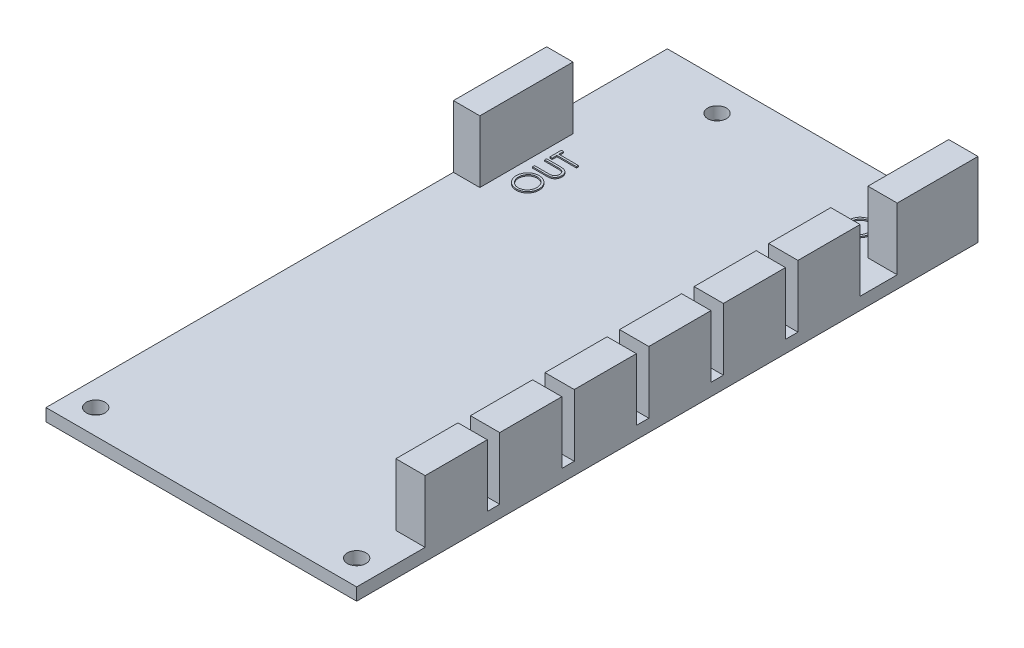
from build123d import *

# Parameters (mm, degrees)
SKIZZE1_W                       = 50
SKIZZE1_H                       = 100
SKIZZE1_R                       = 1.5
AUFSATZ_LINEAR_AUSTRAGEN1_DEPTH = 2
SKIZZE2_W                       = 4.251019897
SKIZZE2_H                       = 15
SKIZZE2_W_2                     = 4.710285564
SKIZZE2_H_2                     = 13
SKIZZE2_H_3                     = 10
AUFSATZ_LINEAR_AUSTRAGEN2_DEPTH = 10
SKIZZE3_W                       = 3.5
SKIZZE3_H                       = 0.314102564
AUFSATZ_LINEAR_AUSTRAGEN3_DEPTH = 0.2


with BuildPart() as part:
    # Skizze1 → Aufsatz-Linear austragen1 (new body)
    with BuildSketch(Plane(origin=(0, 0, 0), x_dir=(1, 0, 0), z_dir=(0, 1, 0))):
        Rectangle(SKIZZE1_W, SKIZZE1_H)
        with Locations(Location((-21, -46, 0), (0, 0, 270))):
            Circle(SKIZZE1_R, mode=Mode.SUBTRACT)
        with Locations(Location((21, -46, 0), (0, 0, 270))):
            Circle(SKIZZE1_R, mode=Mode.SUBTRACT)
        with Locations(Location((-12, 45, 0), (0, 0, 270))):
            Circle(SKIZZE1_R, mode=Mode.SUBTRACT)
    extrude(amount=AUFSATZ_LINEAR_AUSTRAGEN1_DEPTH)

    # Skizze2 → Aufsatz-Linear austragen2 (add)
    with BuildSketch(Plane(origin=(0, 2, 0), x_dir=(1, 0, 0), z_dir=(0, 1, 0))):
        with Locations((-22.874490052, 23.070720831)):
            Rectangle(SKIZZE2_W, SKIZZE2_H)
        with Locations((22.644857218, 43.5)):
            Rectangle(SKIZZE2_W_2, SKIZZE2_H_2)
        with Locations((22.644857218, 26.019961823)):
            Rectangle(SKIZZE2_W_2, SKIZZE2_H_3)
        with Locations((22.644857218, 14.019961823)):
            Rectangle(SKIZZE2_W_2, SKIZZE2_H_3)
        with Locations((22.644857218, 2.019961823)):
            Rectangle(SKIZZE2_W_2, SKIZZE2_H_3)
        with Locations((22.644857218, -9.980038177)):
            Rectangle(SKIZZE2_W_2, SKIZZE2_H_3)
        with Locations((22.644857218, -21.980038177)):
            Rectangle(SKIZZE2_W_2, SKIZZE2_H_3)
        with Locations((22.644857218, -33.980038177)):
            Rectangle(SKIZZE2_W_2, SKIZZE2_H_3)
    extrude(amount=AUFSATZ_LINEAR_AUSTRAGEN2_DEPTH)

    # Skizze3 → Aufsatz-Linear austragen3 (add)
    # profile 1 of 23: a face of its own
    with BuildSketch(Plane(origin=(0, 2, 0), x_dir=(1, 0, 0), z_dir=(0, 1, 0))):
        Polygon((17.25727226, 49.820512821), (17.25727226, 49.483974359), (14.499059119, 48.317307692), (17.25727226, 47.150641026), (17.25727226, 46.814102564), (13.75727226, 48.294871795), (13.75727226, 48.33974359), align=None)
    # profile 2 of 23: a face of its own
    with BuildSketch(Plane(origin=(0, 2, 0), x_dir=(1, 0, 0), z_dir=(0, 1, 0))):
        with BuildLine():
            Line((16.615044695, 42.91025641), (16.404708157, 43.185096154))
            add(Edge.make_bspline(
                [(16.404708157, 43.185096154), (16.428074127, 43.204702042), (16.474491043, 43.243649489), (16.539670587, 43.306308692), (16.600735848, 43.371610334), (16.657977728, 43.439529456), (16.709394494, 43.511288575), (16.757665597, 43.585149374), (16.800933335, 43.662347419), (16.853396321, 43.769099154), (16.908142476, 43.908747002), (16.954045707, 44.084541841), (16.983266883, 44.26805294), (16.986431724, 44.393250539), (16.98804149, 44.45693109)],
                knots=[0, 0, 0, 0, 0.757959112, 1.505699292, 2.245454638, 2.979532153, 3.711538275, 4.438200793, 5.171680507, 5.909471876, 7.393775596, 8.890124382, 10.418191784, 12, 12, 12, 12], degree=3))
            add(Edge.make_bspline(
                [(16.98804149, 44.45693109), (16.987635705, 44.492013963), (16.986827901, 44.561854106), (16.976245676, 44.665508873), (16.961200939, 44.767424406), (16.93942056, 44.867221717), (16.911064482, 44.964702655), (16.877810371, 45.060609455), (16.836429005, 45.153812591), (16.790728811, 45.24543374), (16.739095991, 45.333208898), (16.682795727, 45.416276875), (16.622380598, 45.494258173), (16.558006554, 45.56736888), (16.488873555, 45.634807178), (16.415794868, 45.697653868), (16.337890901, 45.754776303), (16.256622678, 45.807578169), (16.171870749, 45.854562385), (16.084168275, 45.895135531), (15.993850575, 45.92991009), (15.900732626, 45.957681441), (15.805180871, 45.97958644), (15.706992527, 45.994719409), (15.606358183, 46.005206438), (15.53814896, 46.006006811), (15.503766651, 46.006410256)],
                knots=[0, 0, 0, 0, 1.055000685, 2.100209969, 3.131349012, 4.153242145, 5.170189196, 6.184191144, 7.204341339, 8.235672124, 9.263040994, 10.265373269, 11.252624173, 12.22887325, 13.193405896, 14.155809299, 15.126090485, 16.097288279, 17.069732292, 18.038585918, 19.002221264, 19.978698174, 20.959418239, 21.948869816, 22.966084182, 24, 24, 24, 24], degree=3))
            add(Edge.make_bspline(
                [(15.503766651, 46.006410256), (15.452035331, 46.005148437), (15.350467746, 46.002671023), (15.201697135, 45.980622689), (15.059176461, 45.947117598), (14.923796619, 45.896902021), (14.793888261, 45.83498297), (14.671649408, 45.756742359), (14.555232843, 45.666125821), (14.447389895, 45.561851402), (14.34887617, 45.447445586), (14.262125589, 45.324697674), (14.189810706, 45.193913387), (14.12963476, 45.056536756), (14.083378032, 44.911510642), (14.050813908, 44.75909584), (14.029571728, 44.599623845), (14.02753804, 44.490654445), (14.026503029, 44.435196314)],
                knots=[0, 0, 0, 0, 1.029171465, 2.020641659, 2.987623507, 3.938342917, 4.889210282, 5.84687017, 6.821220943, 7.821438502, 8.827599549, 9.822697543, 10.807740252, 11.797342354, 12.80366471, 13.83203677, 14.896651826, 16, 16, 16, 16], degree=3))
            add(Edge.make_bspline(
                [(14.026503029, 44.435196314), (14.028191809, 44.374093625), (14.031515731, 44.253828916), (14.05967498, 44.07746089), (14.105332898, 43.908625124), (14.16923082, 43.747312538), (14.252296108, 43.593977891), (14.352993986, 43.448381231), (14.472282318, 43.310399661), (14.563365447, 43.227428378), (14.609836362, 43.185096154)],
                knots=[0, 0, 0, 0, 1.028121516, 2.023589091, 2.998037872, 3.967518031, 4.937445131, 5.927275754, 6.942489185, 8, 8, 8, 8], degree=3))
            Line((14.609836362, 43.185096154), (14.401603189, 42.91025641))
            add(Edge.make_bspline(
                [(14.401603189, 42.91025641), (14.373064688, 42.932374491), (14.316124385, 42.976504707), (14.235853399, 43.04796316), (14.16034666, 43.123238831), (14.090229095, 43.202900593), (14.024036926, 43.285995692), (13.963989192, 43.373987806), (13.908256744, 43.46535714), (13.857900309, 43.56063566), (13.812750239, 43.659510554), (13.774633302, 43.761878925), (13.741326209, 43.866873502), (13.71410599, 43.974547161), (13.692826271, 44.08525961), (13.678608967, 44.198630992), (13.668866413, 44.314900622), (13.667978584, 44.393342077), (13.66752867, 44.433092949)],
                knots=[0, 0, 0, 0, 0.986756325, 1.968786143, 2.935506311, 3.899499537, 4.868307269, 5.8376204, 6.809456583, 7.792545619, 8.781780509, 9.778496008, 10.776623214, 11.79151764, 12.812666265, 13.856269958, 14.913646641, 16, 16, 16, 16], degree=3))
            add(Edge.make_bspline(
                [(13.66752867, 44.433092949), (13.667790662, 44.470736616), (13.66830872, 44.545172306), (13.676700888, 44.655071057), (13.688150625, 44.762060638), (13.705390756, 44.865835264), (13.725735096, 44.966961239), (13.753006352, 45.064521824), (13.783555519, 45.159477034), (13.819460506, 45.251445375), (13.859976688, 45.340505075), (13.905768247, 45.426368886), (13.956450112, 45.508997318), (14.010905122, 45.589202739), (14.070882424, 45.665800323), (14.135549059, 45.739453848), (14.204687069, 45.810576324), (14.254541923, 45.854579009), (14.279607997, 45.876702724)],
                knots=[0, 0, 0, 0, 1.114604814, 2.203992996, 3.262667896, 4.300477797, 5.318619304, 6.316056647, 7.298880507, 8.271930387, 9.238335007, 10.195173496, 11.151986948, 12.108099108, 13.064862484, 14.031167946, 15.010108607, 16, 16, 16, 16], degree=3))
            add(Edge.make_bspline(
                [(14.279607997, 45.876702724), (14.323149186, 45.912138368), (14.409705896, 45.982581845), (14.549991877, 46.072707528), (14.696460086, 46.149855083), (14.849880015, 46.212231004), (15.009907402, 46.260993737), (15.176622917, 46.294774932), (15.349870859, 46.316726537), (15.467707647, 46.319236826), (15.527604792, 46.320512821)],
                knots=[0, 0, 0, 0, 0.994628077, 1.977248131, 2.950237994, 3.925870899, 4.908910175, 5.911660606, 6.938484602, 8, 8, 8, 8], degree=3))
            add(Edge.make_bspline(
                [(15.527604792, 46.320512821), (15.590557611, 46.318950671), (15.714413354, 46.315877239), (15.8962249, 46.289980724), (16.070162568, 46.247816194), (16.236895627, 46.189755356), (16.395470094, 46.113157586), (16.546555697, 46.020429791), (16.69002907, 45.910666245), (16.824055891, 45.785245472), (16.946591979, 45.647670889), (17.054399036, 45.50035397), (17.144116327, 45.343571524), (17.21911255, 45.179053806), (17.276756997, 45.005568088), (17.317110188, 44.823484729), (17.342227303, 44.633145812), (17.345402511, 44.503283386), (17.347015849, 44.437299679)],
                knots=[0, 0, 0, 0, 1.032901378, 2.032168977, 3.007206631, 3.966850309, 4.924221947, 5.891988639, 6.871730993, 7.884084801, 8.900290346, 9.89161143, 10.874607481, 11.860025555, 12.854717796, 13.869097222, 14.917278314, 16, 16, 16, 16], degree=3))
            add(Edge.make_bspline(
                [(17.347015849, 44.437299679), (17.346534071, 44.397085129), (17.345580441, 44.317484475), (17.336269076, 44.199732965), (17.32077467, 44.085086439), (17.299546287, 43.973267641), (17.273527405, 43.863871092), (17.239466678, 43.75801912), (17.199913825, 43.65513532), (17.155521419, 43.555142639), (17.104770729, 43.459128967), (17.049650159, 43.367111776), (16.988887342, 43.280201087), (16.9244911, 43.196762102), (16.85405259, 43.118673297), (16.779865697, 43.043704477), (16.699729035, 42.974445345), (16.643324482, 42.931691889), (16.615044695, 42.91025641)],
                knots=[0, 0, 0, 0, 1.096705196, 2.170817488, 3.219277236, 4.250701065, 5.274195539, 6.284202015, 7.28098643, 8.279664616, 9.266225751, 10.241373748, 11.203306326, 12.157093976, 13.114198862, 14.069774147, 15.032234603, 16, 16, 16, 16], degree=3))
        make_face()
    # profile 3 of 23: a face of its own
    with BuildSketch(Plane(origin=(0, 2, 0), x_dir=(1, 0, 0), z_dir=(0, 1, 0))):
        with BuildLine():
            Line((16.615044695, 38.961538462), (16.404708157, 39.236378205))
            add(Edge.make_bspline(
                [(16.404708157, 39.236378205), (16.428074127, 39.255984093), (16.474491043, 39.29493154), (16.539670587, 39.357590743), (16.600735848, 39.422892386), (16.657977728, 39.490811507), (16.709394494, 39.562570626), (16.757665597, 39.636431425), (16.800933335, 39.71362947), (16.853396321, 39.820381205), (16.908142476, 39.960029053), (16.954045707, 40.135823892), (16.983266883, 40.319334991), (16.986431724, 40.44453259), (16.98804149, 40.508213141)],
                knots=[0, 0, 0, 0, 0.757959112, 1.505699292, 2.245454638, 2.979532153, 3.711538275, 4.438200793, 5.171680507, 5.909471876, 7.393775596, 8.890124382, 10.418191784, 12, 12, 12, 12], degree=3))
            add(Edge.make_bspline(
                [(16.98804149, 40.508213141), (16.987635705, 40.543296014), (16.986827901, 40.613136158), (16.976245676, 40.716790925), (16.961200939, 40.818706457), (16.93942056, 40.918503769), (16.911064482, 41.015984706), (16.877810371, 41.111891506), (16.836429005, 41.205094642), (16.790728811, 41.296715791), (16.739095991, 41.384490949), (16.682795727, 41.467558927), (16.622380598, 41.545540225), (16.558006554, 41.618650931), (16.488873555, 41.68608923), (16.415794868, 41.748935919), (16.337890901, 41.806058355), (16.256622678, 41.85886022), (16.171870749, 41.905844436), (16.084168275, 41.946417582), (15.993850575, 41.981192141), (15.900732626, 42.008963492), (15.805180871, 42.030868492), (15.706992527, 42.046001461), (15.606358183, 42.056488489), (15.53814896, 42.057288862), (15.503766651, 42.057692308)],
                knots=[0, 0, 0, 0, 1.055000685, 2.100209969, 3.131349012, 4.153242145, 5.170189196, 6.184191144, 7.204341339, 8.235672124, 9.263040994, 10.265373269, 11.252624173, 12.22887325, 13.193405896, 14.155809299, 15.126090485, 16.097288279, 17.069732292, 18.038585918, 19.002221264, 19.978698174, 20.959418239, 21.948869816, 22.966084182, 24, 24, 24, 24], degree=3))
            add(Edge.make_bspline(
                [(15.503766651, 42.057692308), (15.452035331, 42.056430489), (15.350467746, 42.053953074), (15.201697135, 42.03190474), (15.059176461, 41.998399649), (14.923796619, 41.948184072), (14.793888261, 41.886265022), (14.671649408, 41.80802441), (14.555232843, 41.717407873), (14.447389895, 41.613133453), (14.34887617, 41.498727637), (14.262125589, 41.375979726), (14.189810706, 41.245195438), (14.12963476, 41.107818808), (14.083378032, 40.962792694), (14.050813908, 40.810377891), (14.029571728, 40.650905896), (14.02753804, 40.541936496), (14.026503029, 40.486478365)],
                knots=[0, 0, 0, 0, 1.029171465, 2.020641659, 2.987623507, 3.938342917, 4.889210282, 5.84687017, 6.821220943, 7.821438502, 8.827599549, 9.822697543, 10.807740252, 11.797342354, 12.80366471, 13.83203677, 14.896651826, 16, 16, 16, 16], degree=3))
            add(Edge.make_bspline(
                [(14.026503029, 40.486478365), (14.028191809, 40.425375676), (14.031515731, 40.305110967), (14.05967498, 40.128742941), (14.105332898, 39.959907176), (14.16923082, 39.798594589), (14.252296108, 39.645259943), (14.352993986, 39.499663282), (14.472282318, 39.361681712), (14.563365447, 39.27871043), (14.609836362, 39.236378205)],
                knots=[0, 0, 0, 0, 1.028121516, 2.023589091, 2.998037872, 3.967518031, 4.937445131, 5.927275754, 6.942489185, 8, 8, 8, 8], degree=3))
            Line((14.609836362, 39.236378205), (14.401603189, 38.961538462))
            add(Edge.make_bspline(
                [(14.401603189, 38.961538462), (14.373064688, 38.983656542), (14.316124385, 39.027786759), (14.235853399, 39.099245211), (14.16034666, 39.174520882), (14.090229095, 39.254182644), (14.024036926, 39.337277743), (13.963989192, 39.425269857), (13.908256744, 39.516639191), (13.857900309, 39.611917711), (13.812750239, 39.710792605), (13.774633302, 39.813160976), (13.741326209, 39.918155553), (13.71410599, 40.025829212), (13.692826271, 40.136541661), (13.678608967, 40.249913044), (13.668866413, 40.366182674), (13.667978584, 40.444624128), (13.66752867, 40.484375)],
                knots=[0, 0, 0, 0, 0.986756325, 1.968786143, 2.935506311, 3.899499537, 4.868307269, 5.8376204, 6.809456583, 7.792545619, 8.781780509, 9.778496008, 10.776623214, 11.79151764, 12.812666265, 13.856269958, 14.913646641, 16, 16, 16, 16], degree=3))
            add(Edge.make_bspline(
                [(13.66752867, 40.484375), (13.667790662, 40.522018667), (13.66830872, 40.596454357), (13.676700888, 40.706353109), (13.688150625, 40.81334269), (13.705390756, 40.917117315), (13.725735096, 41.01824329), (13.753006352, 41.115803875), (13.783555519, 41.210759085), (13.819460506, 41.302727426), (13.859976688, 41.391787126), (13.905768247, 41.477650937), (13.956450112, 41.56027937), (14.010905122, 41.64048479), (14.070882424, 41.717082374), (14.135549059, 41.790735899), (14.204687069, 41.861858376), (14.254541923, 41.905861061), (14.279607997, 41.927984776)],
                knots=[0, 0, 0, 0, 1.114604814, 2.203992996, 3.262667896, 4.300477797, 5.318619304, 6.316056647, 7.298880507, 8.271930387, 9.238335007, 10.195173496, 11.151986948, 12.108099108, 13.064862484, 14.031167946, 15.010108607, 16, 16, 16, 16], degree=3))
            add(Edge.make_bspline(
                [(14.279607997, 41.927984776), (14.323149186, 41.963420419), (14.409705896, 42.033863896), (14.549991877, 42.12398958), (14.696460086, 42.201137135), (14.849880015, 42.263513056), (15.009907402, 42.312275789), (15.176622917, 42.346056984), (15.349870859, 42.368008588), (15.467707647, 42.370518877), (15.527604792, 42.371794872)],
                knots=[0, 0, 0, 0, 0.994628077, 1.977248131, 2.950237994, 3.925870899, 4.908910175, 5.911660606, 6.938484602, 8, 8, 8, 8], degree=3))
            add(Edge.make_bspline(
                [(15.527604792, 42.371794872), (15.590557611, 42.370232722), (15.714413354, 42.367159291), (15.8962249, 42.341262775), (16.070162568, 42.299098246), (16.236895627, 42.241037407), (16.395470094, 42.164439637), (16.546555697, 42.071711843), (16.69002907, 41.961948296), (16.824055891, 41.836527523), (16.946591979, 41.698952941), (17.054399036, 41.551636022), (17.144116327, 41.394853575), (17.21911255, 41.230335857), (17.276756997, 41.056850139), (17.317110188, 40.87476678), (17.342227303, 40.684427863), (17.345402511, 40.554565438), (17.347015849, 40.488581731)],
                knots=[0, 0, 0, 0, 1.032901378, 2.032168977, 3.007206631, 3.966850309, 4.924221947, 5.891988639, 6.871730993, 7.884084801, 8.900290346, 9.89161143, 10.874607481, 11.860025555, 12.854717796, 13.869097222, 14.917278314, 16, 16, 16, 16], degree=3))
            add(Edge.make_bspline(
                [(17.347015849, 40.488581731), (17.346534071, 40.44836718), (17.345580441, 40.368766527), (17.336269076, 40.251015016), (17.32077467, 40.136368491), (17.299546287, 40.024549692), (17.273527405, 39.915153144), (17.239466678, 39.809301171), (17.199913825, 39.706417372), (17.155521419, 39.606424691), (17.104770729, 39.510411018), (17.049650159, 39.418393828), (16.988887342, 39.331483138), (16.9244911, 39.248044153), (16.85405259, 39.169955349), (16.779865697, 39.094986528), (16.699729035, 39.025727397), (16.643324482, 38.98297394), (16.615044695, 38.961538462)],
                knots=[0, 0, 0, 0, 1.096705196, 2.170817488, 3.219277236, 4.250701065, 5.274195539, 6.284202015, 7.28098643, 8.279664616, 9.266225751, 10.241373748, 11.203306326, 12.157093976, 13.114198862, 14.069774147, 15.032234603, 16, 16, 16, 16], degree=3))
        make_face()
    # profile 4 of 23: a face of its own
    with BuildSketch(Plane(origin=(0, 2, 0), x_dir=(1, 0, 0), z_dir=(0, 1, 0))):
        Polygon((13.75727226, 20.872752432), (17.25727226, 20.410713169), (17.25727226, 20.365841374), (14.385477388, 18.920829355), (17.25727226, 17.479322945), (17.25727226, 17.433750028), (13.75727226, 16.968906278), (13.75727226, 17.284411086), (16.275701747, 17.619547304), (13.75727226, 18.882968778), (13.75727226, 18.95378208), (16.281310721, 20.222111407), (13.75727226, 20.556546503), align=None)
    # profile 5 of 23: a face of its own
    with BuildSketch(Plane(origin=(0, 2, 0), x_dir=(1, 0, 0), z_dir=(0, 1, 0))):
        Polygon((17.25727226, 16.25095756), (17.25727226, 14.276598586), (16.898297901, 14.276598586), (16.898297901, 15.936854996), (15.821374824, 15.936854996), (15.821374824, 14.276598586), (15.462400465, 14.276598586), (15.462400465, 15.936854996), (14.116246619, 15.936854996), (14.116246619, 14.276598586), (13.75727226, 14.276598586), (13.75727226, 16.25095756), align=None)
    # profile 6 of 23: a face of its own
    with BuildSketch(Plane(origin=(0, 2, 0), x_dir=(1, 0, 0), z_dir=(0, 1, 0))):
        Polygon((17.25727226, 12.212496022), (13.75727226, 10.597111407), (13.75727226, 10.938557721), (14.879067131, 11.455985605), (14.879067131, 13.042624227), (13.75727226, 13.574775669), (13.75727226, 13.917624227), (17.25727226, 12.257367817), align=None)
        Polygon((16.575080753, 12.238437528), (15.23804149, 12.872251631), (15.23804149, 11.621450349), align=None, mode=Mode.SUBTRACT)
    # profile 7 of 23: a face of its own
    with BuildSketch(Plane(origin=(0, 2, 0), x_dir=(1, 0, 0), z_dir=(0, 1, 0))):
        with BuildLine():
            Line((14.432452548, 10.417624227), (14.609836362, 10.12175083))
            add(Edge.make_bspline(
                [(14.609836362, 10.12175083), (14.563771977, 10.094232592), (14.475514393, 10.041508712), (14.356256353, 9.953557353), (14.254894196, 9.862424441), (14.172017589, 9.767435108), (14.106768702, 9.66916916), (14.06056647, 9.566985106), (14.031750495, 9.461227295), (14.028250408, 9.389253474), (14.026503029, 9.353321342)],
                knots=[0, 0, 0, 0, 1.272034388, 2.437168799, 3.508375237, 4.49857839, 5.41946034, 6.295179144, 7.148887113, 8, 8, 8, 8], degree=3))
            add(Edge.make_bspline(
                [(14.026503029, 9.353321342), (14.0273577, 9.322634479), (14.029052088, 9.261797699), (14.045332906, 9.172235503), (14.070344976, 9.085253525), (14.106166129, 9.002645543), (14.149503814, 8.925547561), (14.201852804, 8.857949186), (14.260449031, 8.79947355), (14.325867977, 8.751771805), (14.39598089, 8.714740631), (14.46859225, 8.687943849), (14.543382665, 8.670889309), (14.594088308, 8.668718608), (14.619652067, 8.667624227)],
                knots=[0, 0, 0, 0, 1.095270387, 2.171376115, 3.241375676, 4.322296363, 5.380636668, 6.392615365, 7.366724986, 8.328592944, 9.273498763, 10.190095884, 11.087518669, 12, 12, 12, 12], degree=3))
            add(Edge.make_bspline(
                [(14.619652067, 8.667624227), (14.648792917, 8.669098538), (14.708032006, 8.672095596), (14.795431659, 8.697427076), (14.881924229, 8.737276323), (14.935425495, 8.774038967), (14.963201747, 8.793125028)],
                knots=[0, 0, 0, 0, 0.938893495, 1.908633276, 2.914225137, 4, 4, 4, 4], degree=3))
            add(Edge.make_bspline(
                [(14.963201747, 8.793125028), (14.983289551, 8.808751279), (15.025585173, 8.841652935), (15.087490643, 8.898999622), (15.152906486, 8.964541344), (15.221567062, 9.03860576), (15.292218458, 9.122665118), (15.36633341, 9.21499336), (15.443689175, 9.316068432), (15.494843787, 9.387301575), (15.521294695, 9.424134644)],
                knots=[0, 0, 0, 0, 0.72226686, 1.520759855, 2.393439377, 3.351307446, 4.386958158, 5.510256019, 6.712608938, 8, 8, 8, 8], degree=3))
            add(Edge.make_bspline(
                [(15.521294695, 9.424134644), (15.547529286, 9.460953728), (15.597687827, 9.531349013), (15.672034499, 9.629871097), (15.740441652, 9.717853407), (15.801956399, 9.795744257), (15.859261702, 9.861528511), (15.909286317, 9.917611058), (15.954701501, 9.961922801), (15.984139471, 9.98658124), (15.997356394, 9.997652272)],
                knots=[0, 0, 0, 0, 1.452255772, 2.776602448, 3.96446981, 5.032613149, 5.964194703, 6.766668629, 7.446264616, 8, 8, 8, 8], degree=3))
            add(Edge.make_bspline(
                [(15.997356394, 9.997652272), (16.017957431, 10.013124817), (16.058472135, 10.043553654), (16.121796993, 10.083719659), (16.186620258, 10.117858822), (16.253116123, 10.144621154), (16.320351051, 10.167157373), (16.389202297, 10.182315304), (16.459360916, 10.191806701), (16.506574416, 10.192778687), (16.530208958, 10.193265253)],
                knots=[0, 0, 0, 0, 1.068054152, 2.10047183, 3.106115577, 4.101338837, 5.06977816, 6.043150881, 7.020423561, 8, 8, 8, 8], degree=3))
            add(Edge.make_bspline(
                [(16.530208958, 10.193265253), (16.567241833, 10.191965737), (16.640516032, 10.189394482), (16.747501879, 10.167471361), (16.849956506, 10.13327274), (16.94562315, 10.083811522), (17.034278093, 10.022659143), (17.114566833, 9.950386636), (17.182637763, 9.864578942), (17.241422928, 9.769906359), (17.287836275, 9.666948661), (17.323033871, 9.559254678), (17.342711482, 9.446352167), (17.345566962, 9.369752531), (17.347015849, 9.330885445)],
                knots=[0, 0, 0, 0, 1.005541892, 1.989591032, 2.955705311, 3.932863626, 4.905387107, 5.876519979, 6.856563935, 7.871847665, 8.897921447, 9.918317993, 10.943742853, 12, 12, 12, 12], degree=3))
            add(Edge.make_bspline(
                [(17.347015849, 9.330885445), (17.345619946, 9.289635197), (17.342851702, 9.207831022), (17.317920686, 9.087274975), (17.277649202, 8.970981204), (17.23126622, 8.877370416), (17.185148328, 8.80423329), (17.143125509, 8.748461524), (17.09475129, 8.691943786), (17.039891781, 8.634225816), (16.978045107, 8.576285131), (16.909634396, 8.517261686), (16.835077846, 8.457017415), (16.781853345, 8.418261556), (16.754567933, 8.398393458)],
                knots=[0, 0, 0, 0, 1.286821612, 2.551921131, 3.825787379, 5.12137259, 5.803616487, 6.523126609, 7.299589446, 8.125436757, 9.008162487, 9.944516264, 10.946261234, 12, 12, 12, 12], degree=3))
            Line((16.754567933, 8.398393458), (16.539323542, 8.682347785))
            add(Edge.make_bspline(
                [(16.539323542, 8.682347785), (16.561412233, 8.699493717), (16.603949887, 8.732512774), (16.663521194, 8.782642263), (16.717937702, 8.829890902), (16.765202738, 8.876441331), (16.80790517, 8.919834868), (16.844463945, 8.961952222), (16.875242729, 9.002185558), (16.908072981, 9.052906707), (16.940823586, 9.116792269), (16.967946678, 9.196908021), (16.984832693, 9.280403106), (16.986960134, 9.337115296), (16.98804149, 9.365941535)],
                knots=[0, 0, 0, 0, 1.181667846, 2.275615987, 3.290305621, 4.226321945, 5.078535498, 5.862783384, 6.581873284, 7.217493746, 8.414623899, 9.604724551, 10.782505457, 12, 12, 12, 12], degree=3))
            add(Edge.make_bspline(
                [(16.98804149, 9.365941535), (16.98682979, 9.402098057), (16.984493141, 9.471822505), (16.958973156, 9.570812741), (16.918791296, 9.659906666), (16.862476317, 9.736459231), (16.795755325, 9.800196208), (16.71897647, 9.846301667), (16.634194067, 9.874051831), (16.575052411, 9.877438111), (16.544932516, 9.879162689)],
                knots=[0, 0, 0, 0, 1.14458467, 2.207223713, 3.21896685, 4.227309161, 5.202851033, 6.127160689, 7.046193047, 8, 8, 8, 8], degree=3))
            add(Edge.make_bspline(
                [(16.544932516, 9.879162689), (16.526185818, 9.87875126), (16.488661768, 9.877927732), (16.43307713, 9.867216858), (16.377985898, 9.852029161), (16.323143103, 9.829801032), (16.267258527, 9.79986074), (16.210483052, 9.759150944), (16.151383232, 9.708221312), (16.112983081, 9.669131737), (16.092708958, 9.648493618)],
                knots=[0, 0, 0, 0, 0.858526328, 1.718456515, 2.587092892, 3.476767204, 4.426280253, 5.487868114, 6.673670035, 8, 8, 8, 8], degree=3))
            add(Edge.make_bspline(
                [(16.092708958, 9.648493618), (16.085871932, 9.640832246), (16.069628724, 9.622630579), (16.043036443, 9.589354653), (16.010233671, 9.545411855), (15.969646355, 9.491949653), (15.922564893, 9.427982292), (15.86959128, 9.353502736), (15.809005821, 9.269341203), (15.766648281, 9.209619287), (15.744251426, 9.178040894)],
                knots=[0, 0, 0, 0, 0.420754252, 0.999615792, 1.744751191, 2.668019286, 3.750313428, 4.999500688, 6.413464383, 8, 8, 8, 8], degree=3))
            add(Edge.make_bspline(
                [(15.744251426, 9.178040894), (15.716610067, 9.14005498), (15.663086405, 9.066500524), (15.582670725, 8.961842944), (15.504022956, 8.866949136), (15.427645349, 8.781485932), (15.354117256, 8.704609024), (15.282554076, 8.637171303), (15.213468503, 8.578485623), (15.124895928, 8.515306405), (15.016114843, 8.450748585), (14.882836605, 8.395307078), (14.749040284, 8.36034873), (14.659113448, 8.355777215), (14.614744215, 8.353521663)],
                knots=[0, 0, 0, 0, 1.163667725, 2.253281268, 3.268753668, 4.215851969, 5.092017293, 5.902905408, 6.650798638, 7.335211899, 8.59617414, 9.77448103, 10.901945474, 12, 12, 12, 12], degree=3))
            add(Edge.make_bspline(
                [(14.614744215, 8.353521663), (14.583366097, 8.354179166), (14.521219203, 8.355481404), (14.429960529, 8.370437009), (14.341343038, 8.392376417), (14.256381823, 8.425339714), (14.173940033, 8.465887682), (14.094777074, 8.515970242), (14.019981188, 8.576344737), (13.947995881, 8.643448542), (13.882972454, 8.718023173), (13.824816281, 8.796654985), (13.776139929, 8.879854464), (13.736955341, 8.967218915), (13.705822982, 9.058265056), (13.683445694, 9.153088702), (13.66968033, 9.25195391), (13.668253897, 9.319154984), (13.66752867, 9.353321342)],
                knots=[0, 0, 0, 0, 0.983610584, 1.948120116, 2.894308362, 3.843560551, 4.801159957, 5.773581695, 6.77566113, 7.813174769, 8.857584665, 9.875476876, 10.877851407, 11.875574773, 12.875048225, 13.892438445, 14.928473903, 16, 16, 16, 16], degree=3))
            add(Edge.make_bspline(
                [(13.66752867, 9.353321342), (13.668045709, 9.379755519), (13.669073275, 9.43229096), (13.677942406, 9.509788658), (13.690949096, 9.585863262), (13.710779586, 9.659559565), (13.735405905, 9.731795221), (13.76555727, 9.801926341), (13.801450936, 9.870123313), (13.843146357, 9.936465773), (13.891198861, 10.001578856), (13.946730529, 10.065128748), (14.009357793, 10.127842464), (14.079722911, 10.188570366), (14.157074103, 10.248431826), (14.242059496, 10.306313614), (14.334237926, 10.363394372), (14.39910286, 10.399209975), (14.432452548, 10.417624227)],
                knots=[0, 0, 0, 0, 0.915384692, 1.819241058, 2.699029451, 3.586605375, 4.459625921, 5.340865773, 6.228072412, 7.126546901, 8.052715223, 9.028303326, 10.047266019, 11.120332924, 12.245748783, 13.433636234, 14.680528497, 16, 16, 16, 16], degree=3))
        make_face()
    # profile 8 of 23: a face of its own
    with BuildSketch(Plane(origin=(0, 2, 0), x_dir=(1, 0, 0), z_dir=(0, 1, 0))):
        with BuildLine():
            Line((17.25727226, 7.635572945), (17.25727226, 7.321470381))
            Line((17.25727226, 7.321470381), (15.160216971, 7.321470381))
            add(Edge.make_bspline(
                [(15.160216971, 7.321470381), (15.130536235, 7.321517125), (15.074211924, 7.32160583), (14.994043624, 7.321013316), (14.922771165, 7.319353947), (14.860119817, 7.318307788), (14.80637707, 7.315980454), (14.761251759, 7.314082407), (14.724957557, 7.311641851), (14.703776631, 7.308708733), (14.694672099, 7.307447945)],
                knots=[0, 0, 0, 0, 1.528628734, 2.90083645, 4.128790002, 5.200304208, 6.127813768, 6.898992206, 7.526736466, 8, 8, 8, 8], degree=3))
            add(Edge.make_bspline(
                [(14.694672099, 7.307447945), (14.661822491, 7.302275512), (14.597974233, 7.292222093), (14.50710487, 7.266506962), (14.42492876, 7.230882745), (14.349807001, 7.187508277), (14.282856418, 7.131727678), (14.220699124, 7.065337674), (14.166999621, 6.984151297), (14.117596343, 6.893935843), (14.077945882, 6.796638023), (14.047948724, 6.697230021), (14.029670789, 6.597186212), (14.027554124, 6.530210155), (14.026503029, 6.49695115)],
                knots=[0, 0, 0, 0, 1.035924841, 2.013479024, 2.933602255, 3.82183108, 4.706948133, 5.639927629, 6.646101806, 7.731477349, 8.84205456, 9.913728764, 10.963998332, 12, 12, 12, 12], degree=3))
            add(Edge.make_bspline(
                [(14.026503029, 6.49695115), (14.02757682, 6.468397358), (14.0297182, 6.411454693), (14.042980515, 6.326849033), (14.066877706, 6.24444598), (14.097730269, 6.163856475), (14.138430428, 6.088264095), (14.185771441, 6.017722939), (14.240490788, 5.954091544), (14.301910898, 5.896707928), (14.370578537, 5.846465883), (14.446286812, 5.804074591), (14.528786845, 5.768346857), (14.586961234, 5.750837952), (14.61684758, 5.741842977)],
                knots=[0, 0, 0, 0, 0.994510594, 1.983277156, 2.972612928, 3.9776239, 4.982470102, 5.955333794, 6.930747147, 7.898149105, 8.876444039, 9.885893618, 10.913904934, 12, 12, 12, 12], degree=3))
            add(Edge.make_bspline(
                [(14.61684758, 5.741842977), (14.629196154, 5.738842852), (14.656713754, 5.732157364), (14.703235045, 5.725910319), (14.758124409, 5.719403793), (14.821776222, 5.714889223), (14.893977194, 5.710488003), (14.975103452, 5.70785493), (15.064860413, 5.706637897), (15.127497574, 5.706275217), (15.160216971, 5.706085765)],
                knots=[0, 0, 0, 0, 0.558680831, 1.244966039, 2.062412453, 2.990489873, 4.051219941, 5.244515665, 6.560634259, 8, 8, 8, 8], degree=3))
            Line((15.160216971, 5.706085765), (17.25727226, 5.706085765))
            Line((17.25727226, 5.706085765), (17.25727226, 5.391983201))
            Line((17.25727226, 5.391983201), (15.143390048, 5.391983201))
            add(Edge.make_bspline(
                [(15.143390048, 5.391983201), (15.105291259, 5.392234514), (15.030939156, 5.392724967), (14.921993492, 5.397064544), (14.818620393, 5.403783766), (14.720951759, 5.413941771), (14.628871279, 5.425155844), (14.542513483, 5.441200913), (14.461299321, 5.457974238), (14.385367842, 5.479190565), (14.313714395, 5.504784452), (14.244449062, 5.534750043), (14.178138061, 5.571417202), (14.113823685, 5.613259442), (14.051417828, 5.659715759), (13.99238603, 5.713262338), (13.934792936, 5.771126903), (13.880539022, 5.834528349), (13.830429779, 5.902333622), (13.787325808, 5.974663166), (13.749478053, 6.050060549), (13.719581983, 6.129333343), (13.696442299, 6.211965206), (13.679413117, 6.297951869), (13.669698147, 6.387585741), (13.668257959, 6.448551129), (13.66752867, 6.479423105)],
                knots=[0, 0, 0, 0, 1.316364231, 2.568964831, 3.766826305, 4.894964518, 5.961692026, 6.970710131, 7.928946231, 8.826316495, 9.692177228, 10.556379512, 11.43093279, 12.306715499, 13.20629939, 14.115652445, 15.057829886, 16.025681089, 16.996391533, 17.967202739, 18.931442607, 19.907779629, 20.889445314, 21.893507297, 22.933303057, 24, 24, 24, 24], degree=3))
            add(Edge.make_bspline(
                [(13.66752867, 6.479423105), (13.668313435, 6.513092208), (13.669853142, 6.579150867), (13.678675892, 6.676488934), (13.695294286, 6.76980313), (13.71645423, 6.860079007), (13.745637967, 6.946087504), (13.779736092, 7.028980949), (13.821613352, 7.10733963), (13.868206745, 7.182434759), (13.920631383, 7.252259515), (13.977771557, 7.316356918), (14.038711935, 7.374832788), (14.104112301, 7.426701485), (14.173464008, 7.472822369), (14.246963247, 7.512552583), (14.324581564, 7.546665827), (14.378534764, 7.564272394), (14.40580992, 7.573173105)],
                knots=[0, 0, 0, 0, 1.13879206, 2.234305948, 3.301075583, 4.341971843, 5.366689343, 6.369221514, 7.369726634, 8.367512178, 9.355451585, 10.318319045, 11.268648973, 12.207971039, 13.137398894, 14.081662264, 15.030215811, 16, 16, 16, 16], degree=3))
            add(Edge.make_bspline(
                [(14.40580992, 7.573173105), (14.424442494, 7.578350263), (14.464856963, 7.589579635), (14.531743452, 7.601604932), (14.608758369, 7.611714014), (14.695906988, 7.621219572), (14.793256854, 7.62682853), (14.90076577, 7.631745969), (15.018563732, 7.635607588), (15.100618248, 7.635584815), (15.143390048, 7.635572945)],
                knots=[0, 0, 0, 0, 0.625038921, 1.35572334, 2.194682327, 3.136881307, 4.189498639, 5.346923369, 6.617055217, 8, 8, 8, 8], degree=3))
            Line((15.143390048, 7.635572945), (17.25727226, 7.635572945))
        make_face()
    # profile 9 of 23: a face of its own
    with BuildSketch(Plane(origin=(0, 2, 0), x_dir=(1, 0, 0), z_dir=(0, 1, 0))):
        with BuildLine():
            Line((17.25727226, 4.449675509), (17.25727226, 3.749254836))
            add(Edge.make_bspline(
                [(17.25727226, 3.749254836), (17.257116674, 3.702513707), (17.256817931, 3.612765563), (17.255152168, 3.484192293), (17.250377813, 3.367365196), (17.246269229, 3.262345356), (17.238777288, 3.169134701), (17.231616641, 3.087447411), (17.22224298, 3.017659713), (17.213537557, 2.975413862), (17.209595978, 2.956286086)],
                knots=[0, 0, 0, 0, 1.410062039, 2.707475311, 3.878576406, 4.937260626, 5.877586885, 6.699081471, 7.410979367, 8, 8, 8, 8], degree=3))
            add(Edge.make_bspline(
                [(17.209595978, 2.956286086), (17.20326993, 2.930679011), (17.190752786, 2.880011129), (17.164282773, 2.807067606), (17.133701564, 2.737529141), (17.097504006, 2.67165669), (17.056321462, 2.609444143), (17.009913318, 2.550984649), (16.958043234, 2.496612438), (16.902035754, 2.445909141), (16.841402196, 2.399948235), (16.777025827, 2.360175084), (16.709309283, 2.326117534), (16.63801675, 2.298928368), (16.563750889, 2.277055517), (16.48586322, 2.261627866), (16.404701933, 2.252377068), (16.349344067, 2.251435159), (16.321274663, 2.25095756)],
                knots=[0, 0, 0, 0, 1.02737288, 2.032829108, 3.019628684, 3.985738875, 4.958353778, 5.924249254, 6.890702889, 7.883913451, 8.865824512, 9.85161466, 10.829249435, 11.81541824, 12.821369441, 13.843154991, 14.906364023, 16, 16, 16, 16], degree=3))
            add(Edge.make_bspline(
                [(16.321274663, 2.25095756), (16.274639505, 2.25242652), (16.183642233, 2.255292842), (16.051582101, 2.282018478), (15.928390045, 2.32579305), (15.814237506, 2.386123514), (15.711289486, 2.462916438), (15.621172714, 2.55520407), (15.545064994, 2.662515104), (15.49284839, 2.762883658), (15.459249989, 2.851586042), (15.435491357, 2.924825712), (15.41744438, 3.004778476), (15.4010422, 3.09029729), (15.388526019, 3.182042711), (15.379637151, 3.279829985), (15.373921542, 3.383903684), (15.373086467, 3.455243445), (15.372656875, 3.491943137)],
                knots=[0, 0, 0, 0, 1.260402266, 2.459371274, 3.627181936, 4.786749125, 5.93865593, 7.087644312, 8.261344208, 9.485713728, 10.136162886, 10.825977872, 11.566646758, 12.35154167, 13.181268117, 14.0701832, 15.007234106, 16, 16, 16, 16], degree=3))
            Line((15.372656875, 3.491943137), (13.75727226, 2.206085765))
            Line((13.75727226, 2.206085765), (13.75727226, 2.59450724))
            Line((13.75727226, 2.59450724), (15.372656875, 3.880364612))
            Line((15.372656875, 3.880364612), (15.372656875, 4.135572945))
            Line((15.372656875, 4.135572945), (13.75727226, 4.135572945))
            Line((13.75727226, 4.135572945), (13.75727226, 4.449675509))
            Line((13.75727226, 4.449675509), (17.25727226, 4.449675509))
        make_face()
        with BuildLine():
            Line((16.898297901, 4.135572945), (15.731631234, 4.135572945))
            Line((15.731631234, 4.135572945), (15.726723381, 3.494747624))
            add(Edge.make_bspline(
                [(15.726723381, 3.494747624), (15.726710145, 3.464827586), (15.726684489, 3.406834029), (15.730678264, 3.322933362), (15.735221586, 3.244813256), (15.742170917, 3.172772485), (15.751127037, 3.106778973), (15.762329864, 3.046865354), (15.77538244, 2.99293497), (15.795581903, 2.930033619), (15.827602542, 2.859816103), (15.874110695, 2.78341006), (15.932986321, 2.718564887), (15.999239686, 2.662655779), (16.073582073, 2.619591526), (16.152713703, 2.588248306), (16.235951406, 2.568578689), (16.29312325, 2.566240249), (16.321975785, 2.565060124)],
                knots=[0, 0, 0, 0, 1.14660753, 2.222451964, 3.218720504, 4.145691244, 4.995719623, 5.770487122, 6.480909919, 7.121111896, 8.299844659, 9.430703709, 10.534634535, 11.641396424, 12.741395289, 13.810956493, 14.895269934, 16, 16, 16, 16], degree=3))
            add(Edge.make_bspline(
                [(16.321975785, 2.565060124), (16.350130164, 2.566243877), (16.405921871, 2.568589642), (16.487375307, 2.588286417), (16.564802169, 2.620093828), (16.636726647, 2.66469518), (16.702558639, 2.718589073), (16.758107556, 2.782596085), (16.804626537, 2.853492744), (16.83413668, 2.919802966), (16.85226523, 2.979031122), (16.865006394, 3.030463229), (16.875329243, 3.088797999), (16.883355063, 3.153895631), (16.890577383, 3.225638352), (16.895260145, 3.304222607), (16.898090406, 3.38955765), (16.898227126, 3.448704832), (16.898297901, 3.479322945)],
                knots=[0, 0, 0, 0, 1.100801541, 2.181386982, 3.260112282, 4.364594493, 5.481957178, 6.577424609, 7.668452592, 8.790448866, 9.403819393, 10.091598921, 10.863153553, 11.720938239, 12.658472417, 13.685008818, 14.801622349, 16, 16, 16, 16], degree=3))
            Line((16.898297901, 3.479322945), (16.898297901, 4.135572945))
        make_face(mode=Mode.SUBTRACT)
    # profile 10 of 23: a face of its own
    with BuildSketch(Plane(origin=(0, 2, 0), x_dir=(1, 0, 0), z_dir=(0, 1, 0))):
        Polygon((17.25727226, 1.488137048), (17.25727226, -0.486221927), (16.898297901, -0.486221927), (16.898297901, 1.174034483), (15.821374824, 1.174034483), (15.821374824, -0.486221927), (15.462400465, -0.486221927), (15.462400465, 1.174034483), (14.116246619, 1.174034483), (14.116246619, -0.486221927), (13.75727226, -0.486221927), (13.75727226, 1.488137048), align=None)
    # profile 11 of 23: a face of its own
    with BuildSketch(Plane(origin=(0, 2, 0), x_dir=(1, 0, 0), z_dir=(0, 1, 0))):
        Polygon((13.75727226, -0.934939876), (17.25727226, -1.396979138), (17.25727226, -1.441850933), (14.385477388, -2.886862952), (17.25727226, -4.328369363), (17.25727226, -4.373942279), (13.75727226, -4.838786029), (13.75727226, -4.523281222), (16.275701747, -4.188145004), (13.75727226, -2.924723529), (13.75727226, -2.853910228), (16.281310721, -1.585580901), (13.75727226, -1.251145805), align=None)
    # profile 12 of 23: a face of its own
    with BuildSketch(Plane(origin=(0, 2, 0), x_dir=(1, 0, 0), z_dir=(0, 1, 0))):
        Polygon((17.25727226, -5.556734747), (17.25727226, -7.531093722), (16.898297901, -7.531093722), (16.898297901, -5.870837311), (15.821374824, -5.870837311), (15.821374824, -7.531093722), (15.462400465, -7.531093722), (15.462400465, -5.870837311), (14.116246619, -5.870837311), (14.116246619, -7.531093722), (13.75727226, -7.531093722), (13.75727226, -5.556734747), align=None)
    # profile 13 of 23: a face of its own
    with BuildSketch(Plane(origin=(0, 2, 0), x_dir=(1, 0, 0), z_dir=(0, 1, 0))):
        Polygon((13.75727226, -8.15929885), (17.25727226, -8.15929885), (17.25727226, -8.225204299), (14.502564728, -10.537503978), (17.25727226, -10.537503978), (17.25727226, -10.851606542), (13.75727226, -10.851606542), (13.75727226, -10.780092119), (16.505669695, -8.473401414), (13.75727226, -8.473401414), align=None)
    # profile 14 of 23: a face of its own
    with BuildSketch(Plane(origin=(0, 2, 0), x_dir=(1, 0, 0), z_dir=(0, 1, 0))):
        Polygon((16.898297901, -11.345196286), (17.25727226, -11.345196286), (17.25727226, -13.184939876), (16.898297901, -13.184939876), (16.898297901, -12.422119363), (13.75727226, -12.422119363), (13.75727226, -12.108016799), (16.898297901, -12.108016799), align=None)
    # profile 15 of 23: a face of its own
    with BuildSketch(Plane(origin=(0, 2, 0), x_dir=(1, 0, 0), z_dir=(0, 1, 0))):
        with Locations((15.50727226, -15.316350132)):
            Rectangle(SKIZZE3_W, SKIZZE3_H)
    # profile 16 of 23: a face of its own
    with BuildSketch(Plane(origin=(0, 2, 0), x_dir=(1, 0, 0), z_dir=(0, 1, 0))):
        Polygon((13.75727226, -16.236221927), (17.25727226, -16.236221927), (17.25727226, -16.302127376), (14.502564728, -18.614427055), (17.25727226, -18.614427055), (17.25727226, -18.928529619), (13.75727226, -18.928529619), (13.75727226, -18.857015196), (16.505669695, -16.550324491), (13.75727226, -16.550324491), align=None)
    # profile 17 of 23: a face of its own
    with BuildSketch(Plane(origin=(0, 2, 0), x_dir=(1, 0, 0), z_dir=(0, 1, 0))):
        with BuildLine():
            Line((17.25727226, -19.825965517), (17.25727226, -20.512363754))
            add(Edge.make_bspline(
                [(17.25727226, -20.512363754), (17.257220363, -20.55957466), (17.257120928, -20.650032853), (17.254106182, -20.779747908), (17.25007949, -20.89755764), (17.244497597, -21.003208021), (17.237901006, -21.097024119), (17.228648967, -21.178581419), (17.218988672, -21.248520975), (17.209167265, -21.290427424), (17.204688125, -21.309539235)],
                knots=[0, 0, 0, 0, 1.415646017, 2.712440637, 3.8905458, 4.950247383, 5.884950622, 6.709939814, 7.411656543, 8, 8, 8, 8], degree=3))
            add(Edge.make_bspline(
                [(17.204688125, -21.309539235), (17.198066234, -21.333732825), (17.184978489, -21.381549915), (17.158763911, -21.450450132), (17.127684919, -21.516007045), (17.092249249, -21.578427264), (17.051007052, -21.637011271), (17.005262937, -21.692508982), (16.955042072, -21.745238715), (16.899370887, -21.793409257), (16.840301963, -21.837756426), (16.776519802, -21.875799569), (16.7094126, -21.907979046), (16.638293096, -21.934259878), (16.563593536, -21.954243448), (16.485095848, -21.96900794), (16.403069757, -21.978454445), (16.347008695, -21.979353829), (16.318470176, -21.97981167)],
                knots=[0, 0, 0, 0, 0.999487232, 1.975422798, 2.933948774, 3.889618007, 4.832992075, 5.786114792, 6.754729845, 7.731954186, 8.717668599, 9.695514499, 10.68728626, 11.680675814, 12.71351902, 13.766008651, 14.862761406, 16, 16, 16, 16], degree=3))
            add(Edge.make_bspline(
                [(16.318470176, -21.97981167), (16.289692399, -21.979390246), (16.233386735, -21.9785657), (16.151013947, -21.968669414), (16.072295557, -21.955339223), (15.997406107, -21.93484217), (15.926790336, -21.907996497), (15.859369104, -21.876504445), (15.796289432, -21.838520914), (15.737322315, -21.794876084), (15.682412402, -21.74632449), (15.631957608, -21.693071552), (15.58625327, -21.635332259), (15.545196926, -21.573290111), (15.509740646, -21.506340262), (15.477983341, -21.435498109), (15.451312281, -21.360147892), (15.437282219, -21.308005379), (15.430148862, -21.281494363)],
                knots=[0, 0, 0, 0, 1.121902311, 2.195077645, 3.232258892, 4.234102512, 5.217864754, 6.176164875, 7.132989551, 8.084763148, 9.034132444, 9.988522005, 10.94243251, 11.903244335, 12.886203696, 13.894208494, 14.929344452, 16, 16, 16, 16], degree=3))
            add(Edge.make_bspline(
                [(15.430148862, -21.281494363), (15.425485881, -21.259567029), (15.415266687, -21.211512001), (15.40385823, -21.132369279), (15.394120629, -21.040223893), (15.386819492, -20.935201613), (15.380569123, -20.817396708), (15.375601029, -20.686745451), (15.372871176, -20.542991374), (15.372730383, -20.44272013), (15.372656875, -20.390368561)],
                knots=[0, 0, 0, 0, 0.601384939, 1.31797006, 2.144135048, 3.087295005, 4.142315834, 5.309527816, 6.595305764, 8, 8, 8, 8], degree=3))
            Line((15.372656875, -20.390368561), (15.372656875, -20.140068081))
            Line((15.372656875, -20.140068081), (13.75727226, -20.140068081))
            Line((13.75727226, -20.140068081), (13.75727226, -19.825965517))
            Line((13.75727226, -19.825965517), (17.25727226, -19.825965517))
        make_face()
        with BuildLine():
            Line((16.898297901, -20.140068081), (15.731631234, -20.140068081))
            Line((15.731631234, -20.140068081), (15.723918894, -20.752848529))
            add(Edge.make_bspline(
                [(15.723918894, -20.752848529), (15.723900184, -20.782768748), (15.723864063, -20.840529113), (15.727903969, -20.924194442), (15.732360255, -21.001617441), (15.73933899, -21.072966242), (15.74853413, -21.137695596), (15.758542864, -21.196636928), (15.772102707, -21.248927369), (15.791009751, -21.310202191), (15.822627606, -21.378249287), (15.869704284, -21.451785818), (15.928064348, -21.51511576), (15.994582931, -21.569552599), (16.068851182, -21.611741006), (16.147690396, -21.643472066), (16.231150182, -21.661955227), (16.288233978, -21.664449306), (16.317067933, -21.665709106)],
                knots=[0, 0, 0, 0, 1.160368111, 2.240066715, 3.248291599, 4.168343349, 5.019594299, 5.784185847, 6.485545725, 7.113397927, 8.269509094, 9.383373363, 10.487084095, 11.595623793, 12.704274681, 13.786671823, 14.88201193, 16, 16, 16, 16], degree=3))
            add(Edge.make_bspline(
                [(16.317067933, -21.665709106), (16.345204259, -21.664442579), (16.401135795, -21.66192488), (16.483146817, -21.643326273), (16.561149576, -21.611802948), (16.634503492, -21.569266724), (16.700749848, -21.51639294), (16.757792815, -21.454466449), (16.804272816, -21.384751749), (16.834066005, -21.319868563), (16.852287147, -21.262272492), (16.865030566, -21.212239292), (16.875206622, -21.15574901), (16.883445986, -21.092781109), (16.89049949, -21.023824313), (16.895285454, -20.948285987), (16.898086914, -20.866452347), (16.898225869, -20.809641775), (16.898297901, -20.780192279)],
                knots=[0, 0, 0, 0, 1.120550889, 2.227516482, 3.330715807, 4.461473166, 5.594337325, 6.694900473, 7.802844763, 8.919519911, 9.52614448, 10.208195984, 10.975273469, 11.811520316, 12.738076669, 13.736566072, 14.826679847, 16, 16, 16, 16], degree=3))
            Line((16.898297901, -20.780192279), (16.898297901, -20.140068081))
        make_face(mode=Mode.SUBTRACT)
    # profile 18 of 23: a face of its own
    with BuildSketch(Plane(origin=(0, 2, 0), x_dir=(1, 0, 0), z_dir=(0, 1, 0))):
        with BuildLine():
            Line((17.25727226, -22.697760388), (17.25727226, -23.011862952))
            Line((17.25727226, -23.011862952), (15.160216971, -23.011862952))
            add(Edge.make_bspline(
                [(15.160216971, -23.011862952), (15.130536235, -23.011816208), (15.074211924, -23.011727504), (14.994043624, -23.012320018), (14.922771165, -23.013979386), (14.860119817, -23.015025546), (14.80637707, -23.017352879), (14.761251759, -23.019250926), (14.724957557, -23.021691483), (14.703776631, -23.0246246), (14.694672099, -23.025885388)],
                knots=[0, 0, 0, 0, 1.528628734, 2.90083645, 4.128790002, 5.200304208, 6.127813768, 6.898992206, 7.526736466, 8, 8, 8, 8], degree=3))
            add(Edge.make_bspline(
                [(14.694672099, -23.025885388), (14.661822491, -23.031057822), (14.597974233, -23.04111124), (14.50710487, -23.066826371), (14.42492876, -23.102450588), (14.349807001, -23.145825056), (14.282856418, -23.201605655), (14.220699124, -23.267995659), (14.166999621, -23.349182036), (14.117596343, -23.43939749), (14.077945882, -23.536695311), (14.047948724, -23.636103312), (14.029670789, -23.736147122), (14.027554124, -23.803123178), (14.026503029, -23.836382183)],
                knots=[0, 0, 0, 0, 1.035924841, 2.013479024, 2.933602255, 3.82183108, 4.706948133, 5.639927629, 6.646101806, 7.731477349, 8.84205456, 9.913728764, 10.963998332, 12, 12, 12, 12], degree=3))
            add(Edge.make_bspline(
                [(14.026503029, -23.836382183), (14.02757682, -23.864935975), (14.0297182, -23.921878641), (14.042980515, -24.0064843), (14.066877706, -24.088887353), (14.097730269, -24.169476858), (14.138430428, -24.245069238), (14.185771441, -24.315610394), (14.240490788, -24.379241789), (14.301910898, -24.436625405), (14.370578537, -24.486867451), (14.446286812, -24.529258742), (14.528786845, -24.564986476), (14.586961234, -24.582495381), (14.61684758, -24.591490356)],
                knots=[0, 0, 0, 0, 0.994510594, 1.983277156, 2.972612928, 3.9776239, 4.982470102, 5.955333794, 6.930747147, 7.898149105, 8.876444039, 9.885893618, 10.913904934, 12, 12, 12, 12], degree=3))
            add(Edge.make_bspline(
                [(14.61684758, -24.591490356), (14.629196154, -24.594490482), (14.656713754, -24.60117597), (14.703235045, -24.607423015), (14.758124409, -24.61392954), (14.821776222, -24.61844411), (14.893977194, -24.622845331), (14.975103452, -24.625478403), (15.064860413, -24.626695436), (15.127497574, -24.627058117), (15.160216971, -24.627247568)],
                knots=[0, 0, 0, 0, 0.558680831, 1.244966039, 2.062412453, 2.990489873, 4.051219941, 5.244515665, 6.560634259, 8, 8, 8, 8], degree=3))
            Line((15.160216971, -24.627247568), (17.25727226, -24.627247568))
            Line((17.25727226, -24.627247568), (17.25727226, -24.941350132))
            Line((17.25727226, -24.941350132), (15.143390048, -24.941350132))
            add(Edge.make_bspline(
                [(15.143390048, -24.941350132), (15.105291259, -24.941098819), (15.030939156, -24.940608366), (14.921993492, -24.93626879), (14.818620393, -24.929549568), (14.720951759, -24.919391562), (14.628871279, -24.908177489), (14.542513483, -24.892132421), (14.461299321, -24.875359096), (14.385367842, -24.854142768), (14.313714395, -24.828548881), (14.244449062, -24.79858329), (14.178138061, -24.761916132), (14.113823685, -24.720073891), (14.051417828, -24.673617574), (13.99238603, -24.620070995), (13.934792936, -24.562206431), (13.880539022, -24.498804984), (13.830429779, -24.430999712), (13.787325808, -24.358670168), (13.749478053, -24.283272784), (13.719581983, -24.203999991), (13.696442299, -24.121368128), (13.679413117, -24.035381465), (13.669698147, -23.945747592), (13.668257959, -23.884782204), (13.66752867, -23.853910228)],
                knots=[0, 0, 0, 0, 1.316364231, 2.568964831, 3.766826305, 4.894964518, 5.961692026, 6.970710131, 7.928946231, 8.826316495, 9.692177228, 10.556379512, 11.43093279, 12.306715499, 13.20629939, 14.115652445, 15.057829886, 16.025681089, 16.996391533, 17.967202739, 18.931442607, 19.907779629, 20.889445314, 21.893507297, 22.933303057, 24, 24, 24, 24], degree=3))
            add(Edge.make_bspline(
                [(13.66752867, -23.853910228), (13.668313435, -23.820241125), (13.669853142, -23.754182467), (13.678675892, -23.656844399), (13.695294286, -23.563530203), (13.71645423, -23.473254326), (13.745637967, -23.387245829), (13.779736092, -23.304352384), (13.821613352, -23.225993703), (13.868206745, -23.150898575), (13.920631383, -23.081073819), (13.977771557, -23.016976415), (14.038711935, -22.958500545), (14.104112301, -22.906631849), (14.173464008, -22.860510964), (14.246963247, -22.820780751), (14.324581564, -22.786667506), (14.378534764, -22.769060939), (14.40580992, -22.760160228)],
                knots=[0, 0, 0, 0, 1.13879206, 2.234305948, 3.301075583, 4.341971843, 5.366689343, 6.369221514, 7.369726634, 8.367512178, 9.355451585, 10.318319045, 11.268648973, 12.207971039, 13.137398894, 14.081662264, 15.030215811, 16, 16, 16, 16], degree=3))
            add(Edge.make_bspline(
                [(14.40580992, -22.760160228), (14.424442494, -22.75498307), (14.464856963, -22.743753699), (14.531743452, -22.731728401), (14.608758369, -22.721619319), (14.695906988, -22.712113761), (14.793256854, -22.706504803), (14.90076577, -22.701587364), (15.018563732, -22.697725746), (15.100618248, -22.697748518), (15.143390048, -22.697760388)],
                knots=[0, 0, 0, 0, 0.625038921, 1.35572334, 2.194682327, 3.136881307, 4.189498639, 5.346923369, 6.617055217, 8, 8, 8, 8], degree=3))
            Line((15.143390048, -22.697760388), (17.25727226, -22.697760388))
        make_face()
    # profile 19 of 23: a face of its own
    with BuildSketch(Plane(origin=(0, 2, 0), x_dir=(1, 0, 0), z_dir=(0, 1, 0))):
        Polygon((16.898297901, -25.47981167), (17.25727226, -25.47981167), (17.25727226, -27.31955526), (16.898297901, -27.31955526), (16.898297901, -26.556734747), (13.75727226, -26.556734747), (13.75727226, -26.242632183), (16.898297901, -26.242632183), align=None)
    # profile 20 of 23: a face of its own
    with BuildSketch(Plane(origin=(0, 2, 0), x_dir=(1, 0, 0), z_dir=(0, 1, 0))):
        with BuildLine():
            Line((14.432452548, -27.588786029), (14.609836362, -27.884659427))
            add(Edge.make_bspline(
                [(14.609836362, -27.884659427), (14.563771977, -27.912177664), (14.475514393, -27.964901545), (14.356256353, -28.052852904), (14.254894196, -28.143985815), (14.172017589, -28.238975149), (14.106768702, -28.337241097), (14.06056647, -28.43942515), (14.031750495, -28.545182961), (14.028250408, -28.617156783), (14.026503029, -28.653088914)],
                knots=[0, 0, 0, 0, 1.272034388, 2.437168799, 3.508375237, 4.49857839, 5.41946034, 6.295179144, 7.148887113, 8, 8, 8, 8], degree=3))
            add(Edge.make_bspline(
                [(14.026503029, -28.653088914), (14.0273577, -28.683775778), (14.029052088, -28.744612557), (14.045332906, -28.834174754), (14.070344976, -28.921156731), (14.106166129, -29.003764713), (14.149503814, -29.080862695), (14.201852804, -29.148461071), (14.260449031, -29.206936707), (14.325867977, -29.254638452), (14.39598089, -29.291669626), (14.46859225, -29.318466408), (14.543382665, -29.335520948), (14.594088308, -29.337691649), (14.619652067, -29.338786029)],
                knots=[0, 0, 0, 0, 1.095270387, 2.171376115, 3.241375676, 4.322296363, 5.380636668, 6.392615365, 7.366724986, 8.328592944, 9.273498763, 10.190095884, 11.087518669, 12, 12, 12, 12], degree=3))
            add(Edge.make_bspline(
                [(14.619652067, -29.338786029), (14.648792917, -29.337311719), (14.708032006, -29.33431466), (14.795431659, -29.30898318), (14.881924229, -29.269133934), (14.935425495, -29.23237129), (14.963201747, -29.213285228)],
                knots=[0, 0, 0, 0, 0.938893495, 1.908633276, 2.914225137, 4, 4, 4, 4], degree=3))
            add(Edge.make_bspline(
                [(14.963201747, -29.213285228), (14.983289551, -29.197658977), (15.025585173, -29.164757322), (15.087490643, -29.107410634), (15.152906486, -29.041868912), (15.221567062, -28.967804496), (15.292218458, -28.883745139), (15.36633341, -28.791416897), (15.443689175, -28.690341825), (15.494843787, -28.619108682), (15.521294695, -28.582275613)],
                knots=[0, 0, 0, 0, 0.72226686, 1.520759855, 2.393439377, 3.351307446, 4.386958158, 5.510256019, 6.712608938, 8, 8, 8, 8], degree=3))
            add(Edge.make_bspline(
                [(15.521294695, -28.582275613), (15.547529286, -28.545456528), (15.597687827, -28.475061243), (15.672034499, -28.376539159), (15.740441652, -28.288556849), (15.801956399, -28.210666), (15.859261702, -28.144881746), (15.909286317, -28.088799199), (15.954701501, -28.044487456), (15.984139471, -28.019829016), (15.997356394, -28.008757985)],
                knots=[0, 0, 0, 0, 1.452255772, 2.776602448, 3.96446981, 5.032613149, 5.964194703, 6.766668629, 7.446264616, 8, 8, 8, 8], degree=3))
            add(Edge.make_bspline(
                [(15.997356394, -28.008757985), (16.017957431, -27.993285439), (16.058472135, -27.962856603), (16.121796993, -27.922690597), (16.186620258, -27.888551434), (16.253116123, -27.861789102), (16.320351051, -27.839252883), (16.389202297, -27.824094953), (16.459360916, -27.814603556), (16.506574416, -27.813631569), (16.530208958, -27.813145004)],
                knots=[0, 0, 0, 0, 1.068054152, 2.10047183, 3.106115577, 4.101338837, 5.06977816, 6.043150881, 7.020423561, 8, 8, 8, 8], degree=3))
            add(Edge.make_bspline(
                [(16.530208958, -27.813145004), (16.567241833, -27.814444519), (16.640516032, -27.817015774), (16.747501879, -27.838938895), (16.849956506, -27.873137516), (16.94562315, -27.922598734), (17.034278093, -27.983751114), (17.114566833, -28.056023621), (17.182637763, -28.141831314), (17.241422928, -28.236503898), (17.287836275, -28.339461595), (17.323033871, -28.447155578), (17.342711482, -28.560058089), (17.345566962, -28.636657725), (17.347015849, -28.675524811)],
                knots=[0, 0, 0, 0, 1.005541892, 1.989591032, 2.955705311, 3.932863626, 4.905387107, 5.876519979, 6.856563935, 7.871847665, 8.897921447, 9.918317993, 10.943742853, 12, 12, 12, 12], degree=3))
            add(Edge.make_bspline(
                [(17.347015849, -28.675524811), (17.345619946, -28.71677506), (17.342851702, -28.798579235), (17.317920686, -28.919135282), (17.277649202, -29.035429053), (17.23126622, -29.12903984), (17.185148328, -29.202176967), (17.143125509, -29.257948733), (17.09475129, -29.314466471), (17.039891781, -29.372184441), (16.978045107, -29.430125125), (16.909634396, -29.48914857), (16.835077846, -29.549392841), (16.781853345, -29.588148701), (16.754567933, -29.608016799)],
                knots=[0, 0, 0, 0, 1.286821612, 2.551921131, 3.825787379, 5.12137259, 5.803616487, 6.523126609, 7.299589446, 8.125436757, 9.008162487, 9.944516264, 10.946261234, 12, 12, 12, 12], degree=3))
            Line((16.754567933, -29.608016799), (16.539323542, -29.324062472))
            add(Edge.make_bspline(
                [(16.539323542, -29.324062472), (16.561412233, -29.306916539), (16.603949887, -29.273897483), (16.663521194, -29.223767993), (16.717937702, -29.176519354), (16.765202738, -29.129968925), (16.80790517, -29.086575389), (16.844463945, -29.044458034), (16.875242729, -29.004224698), (16.908072981, -28.95350355), (16.940823586, -28.889617988), (16.967946678, -28.809502235), (16.984832693, -28.72600715), (16.986960134, -28.66929496), (16.98804149, -28.640468722)],
                knots=[0, 0, 0, 0, 1.181667846, 2.275615987, 3.290305621, 4.226321945, 5.078535498, 5.862783384, 6.581873284, 7.217493746, 8.414623899, 9.604724551, 10.782505457, 12, 12, 12, 12], degree=3))
            add(Edge.make_bspline(
                [(16.98804149, -28.640468722), (16.98682979, -28.604312199), (16.984493141, -28.534587752), (16.958973156, -28.435597516), (16.918791296, -28.346503591), (16.862476317, -28.269951026), (16.795755325, -28.206214049), (16.71897647, -28.16010859), (16.634194067, -28.132358425), (16.575052411, -28.128972146), (16.544932516, -28.127247568)],
                knots=[0, 0, 0, 0, 1.14458467, 2.207223713, 3.21896685, 4.227309161, 5.202851033, 6.127160689, 7.046193047, 8, 8, 8, 8], degree=3))
            add(Edge.make_bspline(
                [(16.544932516, -28.127247568), (16.526185818, -28.127658996), (16.488661768, -28.128482525), (16.43307713, -28.139193398), (16.377985898, -28.154381095), (16.323143103, -28.176609224), (16.267258527, -28.206549516), (16.210483052, -28.247259313), (16.151383232, -28.298188944), (16.112983081, -28.33727852), (16.092708958, -28.357916638)],
                knots=[0, 0, 0, 0, 0.858526328, 1.718456515, 2.587092892, 3.476767204, 4.426280253, 5.487868114, 6.673670035, 8, 8, 8, 8], degree=3))
            add(Edge.make_bspline(
                [(16.092708958, -28.357916638), (16.085871932, -28.365578011), (16.069628724, -28.383779678), (16.043036443, -28.417055604), (16.010233671, -28.460998402), (15.969646355, -28.514460603), (15.922564893, -28.578427965), (15.86959128, -28.652907521), (15.809005821, -28.737069054), (15.766648281, -28.79679097), (15.744251426, -28.828369363)],
                knots=[0, 0, 0, 0, 0.420754252, 0.999615792, 1.744751191, 2.668019286, 3.750313428, 4.999500688, 6.413464383, 8, 8, 8, 8], degree=3))
            add(Edge.make_bspline(
                [(15.744251426, -28.828369363), (15.716610067, -28.866355276), (15.663086405, -28.939909732), (15.582670725, -29.044567312), (15.504022956, -29.13946112), (15.427645349, -29.224924324), (15.354117256, -29.301801232), (15.282554076, -29.369238953), (15.213468503, -29.427924633), (15.124895928, -29.491103852), (15.016114843, -29.555661671), (14.882836605, -29.611103179), (14.749040284, -29.646061526), (14.659113448, -29.650633042), (14.614744215, -29.652888593)],
                knots=[0, 0, 0, 0, 1.163667725, 2.253281268, 3.268753668, 4.215851969, 5.092017293, 5.902905408, 6.650798638, 7.335211899, 8.59617414, 9.77448103, 10.901945474, 12, 12, 12, 12], degree=3))
            add(Edge.make_bspline(
                [(14.614744215, -29.652888593), (14.583366097, -29.65223109), (14.521219203, -29.650928852), (14.429960529, -29.635973247), (14.341343038, -29.614033839), (14.256381823, -29.581070543), (14.173940033, -29.540522575), (14.094777074, -29.490440014), (14.019981188, -29.43006552), (13.947995881, -29.362961714), (13.882972454, -29.288387083), (13.824816281, -29.209755271), (13.776139929, -29.126555792), (13.736955341, -29.039191341), (13.705822982, -28.948145201), (13.683445694, -28.853321554), (13.66968033, -28.754456347), (13.668253897, -28.687255273), (13.66752867, -28.653088914)],
                knots=[0, 0, 0, 0, 0.983610584, 1.948120116, 2.894308362, 3.843560551, 4.801159957, 5.773581695, 6.77566113, 7.813174769, 8.857584665, 9.875476876, 10.877851407, 11.875574773, 12.875048225, 13.892438445, 14.928473903, 16, 16, 16, 16], degree=3))
            add(Edge.make_bspline(
                [(13.66752867, -28.653088914), (13.668045709, -28.626654738), (13.669073275, -28.574119296), (13.677942406, -28.496621599), (13.690949096, -28.420546994), (13.710779586, -28.346850691), (13.735405905, -28.274615036), (13.76555727, -28.204483916), (13.801450936, -28.136286943), (13.843146357, -28.069944484), (13.891198861, -28.0048314), (13.946730529, -27.941281508), (14.009357793, -27.878567792), (14.079722911, -27.817839891), (14.157074103, -27.75797843), (14.242059496, -27.700096643), (14.334237926, -27.643015884), (14.39910286, -27.607200281), (14.432452548, -27.588786029)],
                knots=[0, 0, 0, 0, 0.915384692, 1.819241058, 2.699029451, 3.586605375, 4.459625921, 5.340865773, 6.228072412, 7.126546901, 8.052715223, 9.028303326, 10.047266019, 11.120332924, 12.245748783, 13.433636234, 14.680528497, 16, 16, 16, 16], degree=3))
        make_face()
    # profile 21 of 23: a face of its own
    with BuildSketch(Plane(origin=(0, 2, 0), x_dir=(1, 0, 0), z_dir=(0, 1, 0))):
        with BuildLine():
            add(Edge.make_bspline(
                [(-19.281537915, 19.939421209), (-19.279924069, 20.004236381), (-19.276754343, 20.131538727), (-19.251689556, 20.318460249), (-19.21043554, 20.497445987), (-19.15217606, 20.66859884), (-19.076649966, 20.831267869), (-18.984907391, 20.985912495), (-18.876390797, 21.132069264), (-18.752693648, 21.26873212), (-18.617225082, 21.393400305), (-18.472203412, 21.502797285), (-18.319451945, 21.595083961), (-18.158962712, 21.670630657), (-17.991110412, 21.72993982), (-17.814954319, 21.770855986), (-17.6316482, 21.796994923), (-17.506621257, 21.800050592), (-17.443196569, 21.801600697)],
                knots=[0, 0, 0, 0, 1.065064174, 2.09187391, 3.093564831, 4.079973196, 5.057907931, 6.036227367, 7.030399151, 8.044883615, 9.061699972, 10.052012555, 11.025713132, 11.989727027, 12.962874294, 13.945865945, 14.957962116, 16, 16, 16, 16], degree=3))
            add(Edge.make_bspline(
                [(-17.443196569, 21.801600697), (-17.380239449, 21.80005007), (-17.256143671, 21.796993606), (-17.073995548, 21.770834777), (-16.89892203, 21.72975725), (-16.731313334, 21.671364985), (-16.571150061, 21.595760318), (-16.418282956, 21.503337782), (-16.272873934, 21.394148425), (-16.136472099, 21.270009645), (-16.011696002, 21.134283009), (-15.901638625, 20.9898187), (-15.809311775, 20.837071306), (-15.732921668, 20.677623741), (-15.674848499, 20.510223972), (-15.632569315, 20.336090171), (-15.606689864, 20.154273598), (-15.60361408, 20.030418549), (-15.602050735, 19.967466081)],
                knots=[0, 0, 0, 0, 1.043748596, 2.057349401, 3.045489418, 4.02252776, 4.995289225, 5.97782527, 6.980224157, 8.006516136, 9.032559198, 10.034193337, 11.013412982, 11.987833483, 12.961212594, 13.946489799, 14.956251404, 16, 16, 16, 16], degree=3))
            add(Edge.make_bspline(
                [(-15.602050735, 19.967466081), (-15.603600122, 19.904041762), (-15.606654376, 19.779015546), (-15.632835781, 19.595478511), (-15.673777085, 19.419200767), (-15.732286521, 19.250686416), (-15.807903752, 19.089841486), (-15.900108131, 18.936351404), (-16.009515272, 18.790832256), (-16.133681846, 18.65449051), (-16.268853398, 18.529741312), (-16.413687653, 18.420981936), (-16.56534311, 18.328756823), (-16.724240634, 18.25339349), (-16.889612077, 18.193729031), (-17.062560554, 18.153024213), (-17.24210006, 18.126688261), (-17.364342959, 18.123653414), (-17.426369645, 18.122113517)],
                knots=[0, 0, 0, 0, 1.053102029, 2.075944431, 3.073151272, 4.055350789, 5.033113405, 6.020478099, 7.024410459, 8.052272461, 9.079885166, 10.07527673, 11.055994387, 12.023226415, 12.992069828, 13.970394897, 14.97016774, 16, 16, 16, 16], degree=3))
            add(Edge.make_bspline(
                [(-17.426369645, 18.122113517), (-17.468002315, 18.122648153), (-17.550742438, 18.123710679), (-17.673609038, 18.136502371), (-17.794499696, 18.155064073), (-17.913070644, 18.181665985), (-18.029031629, 18.216457652), (-18.143182392, 18.25750968), (-18.254366115, 18.307649525), (-18.363109507, 18.364330173), (-18.467717413, 18.427591981), (-18.566596996, 18.49746773), (-18.660577993, 18.571503099), (-18.747224997, 18.652666493), (-18.829058653, 18.738282938), (-18.90482137, 18.829741316), (-18.975196321, 18.92648356), (-19.038616662, 19.02892594), (-19.095975797, 19.134544215), (-19.145197648, 19.243420993), (-19.187443709, 19.354077564), (-19.221684534, 19.467032212), (-19.24871657, 19.581984984), (-19.267123924, 19.699186769), (-19.279948242, 19.818544195), (-19.281005744, 19.898955514), (-19.281537915, 19.939421209)],
                knots=[0, 0, 0, 0, 1.037015668, 2.060948919, 3.074880161, 4.083647147, 5.086022904, 6.090072063, 7.104153813, 8.122640571, 9.144368836, 10.147691507, 11.138137339, 12.123020368, 13.103399296, 14.087645067, 15.080126199, 16.082011238, 17.087798457, 18.072939717, 19.057185487, 20.037253025, 21.01195951, 21.997135196, 22.992090687, 24, 24, 24, 24], degree=3))
        make_face()
        with BuildLine():
            add(Edge.make_bspline(
                [(-18.922563556, 19.954845889), (-18.922160078, 19.921630831), (-18.921356979, 19.855518252), (-18.910720385, 19.757239996), (-18.895669108, 19.660224416), (-18.873809377, 19.564659251), (-18.845534764, 19.470344082), (-18.811433349, 19.377237038), (-18.770216678, 19.285657351), (-18.723863524, 19.195719431), (-18.671213756, 19.109500549), (-18.615304845, 19.026793065), (-18.554059472, 18.949748271), (-18.488802161, 18.877307786), (-18.41896658, 18.809651764), (-18.345011348, 18.746810046), (-18.266616587, 18.688834166), (-18.184104926, 18.636421837), (-18.097937045, 18.589778956), (-18.009760103, 18.548017629), (-17.918537838, 18.513399083), (-17.824839503, 18.485976036), (-17.729078006, 18.462700153), (-17.630731605, 18.448099796), (-17.530139334, 18.437358399), (-17.462157093, 18.436599785), (-17.427771889, 18.436216081)],
                knots=[0, 0, 0, 0, 1.008406545, 2.007172654, 2.999155034, 3.989332444, 4.982025741, 5.988181096, 6.998684226, 8.030553839, 9.059268815, 10.065399129, 11.060956322, 12.046057109, 13.024974577, 14.012068307, 14.991706172, 15.984221787, 16.978487447, 17.966117052, 18.945677757, 19.938371053, 20.93015022, 21.936155317, 22.956113857, 24, 24, 24, 24], degree=3))
            add(Edge.make_bspline(
                [(-17.427771889, 18.436216081), (-17.377210818, 18.43749386), (-17.277741549, 18.440007646), (-17.131957004, 18.4619236), (-16.991715479, 18.495950283), (-16.85785287, 18.545282547), (-16.729772246, 18.608215583), (-16.607972051, 18.684981111), (-16.492488215, 18.776282141), (-16.384180398, 18.879931094), (-16.285362919, 18.993268492), (-16.198501835, 19.113558446), (-16.125397124, 19.239849267), (-16.064283229, 19.371413048), (-16.018242562, 19.509373057), (-15.985415589, 19.652844748), (-15.964139494, 19.801831292), (-15.962073079, 19.903356986), (-15.961025094, 19.954845889)],
                knots=[0, 0, 0, 0, 1.032022337, 2.030307203, 3.003823408, 3.974715386, 4.937372378, 5.913284036, 6.909147208, 7.938749767, 8.970518239, 9.975863271, 10.963918693, 11.946286286, 12.933361397, 13.927862637, 14.949112547, 16, 16, 16, 16], degree=3))
            add(Edge.make_bspline(
                [(-15.961025094, 19.954845889), (-15.961500215, 19.989455527), (-15.962442522, 20.058096833), (-15.971946821, 20.16019036), (-15.987157592, 20.260454062), (-16.009166147, 20.358702686), (-16.036346492, 20.45506496), (-16.070060909, 20.549250124), (-16.110476414, 20.641226895), (-16.155518158, 20.731447544), (-16.206684364, 20.817891943), (-16.261839572, 20.900097742), (-16.322004293, 20.9770098), (-16.38638517, 21.049416297), (-16.456006077, 21.116598165), (-16.529511857, 21.179260959), (-16.608073002, 21.23623442), (-16.690246715, 21.28846907), (-16.775786379, 21.335681066), (-16.864205739, 21.376234435), (-16.95503057, 21.410867851), (-17.048327604, 21.438786308), (-17.143886977, 21.460674483), (-17.241845456, 21.475753666), (-17.34200469, 21.486302304), (-17.409748561, 21.487097354), (-17.44389769, 21.487498132)],
                knots=[0, 0, 0, 0, 1.047334373, 2.07717862, 3.100662057, 4.115010574, 5.122652213, 6.129548646, 7.140165612, 8.16200981, 9.179904151, 10.178566626, 11.156366481, 12.133321541, 13.108841334, 14.082538371, 15.054589433, 16.043660176, 17.028268541, 18.009491307, 18.985652105, 19.968123554, 20.954864208, 21.950389976, 22.966808393, 24, 24, 24, 24], degree=3))
            add(Edge.make_bspline(
                [(-17.44389769, 21.487498132), (-17.477813195, 21.487097019), (-17.545090845, 21.486301338), (-17.644551663, 21.475758863), (-17.741804875, 21.460657973), (-17.836468677, 21.438895265), (-17.928567204, 21.410845112), (-18.018013946, 21.376257778), (-18.105142162, 21.335472493), (-18.18973638, 21.288664215), (-18.270911412, 21.236048591), (-18.348512735, 21.178553605), (-18.421089543, 21.11519103), (-18.490409026, 21.047754635), (-18.555084649, 20.974623105), (-18.614866517, 20.895783676), (-18.672448201, 20.813199347), (-18.723408629, 20.725002534), (-18.770706125, 20.634306766), (-18.811058148, 20.541157124), (-18.845714821, 20.446883922), (-18.873893782, 20.351110238), (-18.895585375, 20.253881341), (-18.910733854, 20.155253776), (-18.921353325, 20.055571807), (-18.922158865, 19.988527741), (-18.922563556, 19.954845889)],
                knots=[0, 0, 0, 0, 1.029877221, 2.042951179, 3.035109885, 4.018542222, 4.991021277, 5.957494829, 6.929429462, 7.911425532, 8.892163142, 9.866273635, 10.842761649, 11.81676864, 12.802607151, 13.805177466, 14.821356543, 15.858816981, 16.897175917, 17.927346774, 18.940346092, 19.946830556, 20.957962087, 21.964146003, 22.97721996, 24, 24, 24, 24], degree=3))
        make_face(mode=Mode.SUBTRACT)
    # profile 22 of 23: a face of its own
    with BuildSketch(Plane(origin=(0, 2, 0), x_dir=(1, 0, 0), z_dir=(0, 1, 0))):
        with BuildLine():
            Line((-19.191794325, 22.519549415), (-19.191794325, 22.833651979))
            Line((-19.191794325, 22.833651979), (-17.094739037, 22.833651979))
            add(Edge.make_bspline(
                [(-17.094739037, 22.833651979), (-17.065058301, 22.833605235), (-17.00873399, 22.83351653), (-16.928565689, 22.834109044), (-16.85729323, 22.835768412), (-16.794641883, 22.836814572), (-16.740899135, 22.839141905), (-16.695773825, 22.841039952), (-16.659479622, 22.843480509), (-16.638298696, 22.846413626), (-16.629194165, 22.847674415)],
                knots=[0, 0, 0, 0, 1.528628734, 2.90083645, 4.128790002, 5.200304208, 6.127813768, 6.898992206, 7.526736466, 8, 8, 8, 8], degree=3))
            add(Edge.make_bspline(
                [(-16.629194165, 22.847674415), (-16.596095558, 22.852792898), (-16.532200186, 22.862673899), (-16.441277516, 22.888925877), (-16.359182599, 22.923923991), (-16.284063663, 22.967341246), (-16.216398097, 23.022199134), (-16.15566656, 23.090306897), (-16.100477029, 23.170443454), (-16.052359693, 23.261460682), (-16.012394191, 23.358439699), (-15.982489738, 23.457903806), (-15.964188232, 23.55793335), (-15.962074655, 23.624911276), (-15.961025094, 23.658171209)],
                knots=[0, 0, 0, 0, 1.042777144, 2.01303441, 2.939567723, 3.817555404, 4.708046775, 5.641195415, 6.651191522, 7.732783915, 8.843021186, 9.914367358, 10.964315445, 12, 12, 12, 12], degree=3))
            add(Edge.make_bspline(
                [(-15.961025094, 23.658171209), (-15.962092992, 23.68672746), (-15.964222619, 23.743675028), (-15.977572705, 23.828244071), (-16.001158469, 23.910869758), (-16.033286584, 23.990902991), (-16.072795553, 24.067043096), (-16.120126656, 24.137337935), (-16.175258224, 24.200333525), (-16.236359218, 24.257820512), (-16.305212973, 24.307585688), (-16.380158384, 24.351585886), (-16.463193836, 24.386530132), (-16.521514015, 24.404222298), (-16.551369645, 24.413279382)],
                knots=[0, 0, 0, 0, 0.994718802, 1.98369237, 2.973235266, 3.981451368, 4.982709966, 5.955777334, 6.925228988, 7.892833478, 8.871333226, 9.877970804, 10.913677552, 12, 12, 12, 12], degree=3))
            add(Edge.make_bspline(
                [(-16.551369645, 24.413279382), (-16.56371822, 24.416279508), (-16.59123582, 24.422964996), (-16.63775711, 24.429212041), (-16.692646474, 24.435718566), (-16.756298287, 24.440233136), (-16.82849926, 24.444634357), (-16.909625517, 24.44726743), (-16.999382478, 24.448484463), (-17.06201964, 24.448847143), (-17.094739037, 24.449036594)],
                knots=[0, 0, 0, 0, 0.558680831, 1.244966039, 2.062412453, 2.990489873, 4.051219941, 5.244515665, 6.560634259, 8, 8, 8, 8], degree=3))
            Line((-17.094739037, 24.449036594), (-19.191794325, 24.449036594))
            Line((-19.191794325, 24.449036594), (-19.191794325, 24.763139158))
            Line((-19.191794325, 24.763139158), (-17.077912113, 24.763139158))
            add(Edge.make_bspline(
                [(-17.077912113, 24.763139158), (-17.039813742, 24.762885002), (-16.965462454, 24.762389), (-16.85651099, 24.758088926), (-16.753158379, 24.75123015), (-16.655388611, 24.741548159), (-16.563558815, 24.728690239), (-16.47706413, 24.714523742), (-16.396381432, 24.69616746), (-16.320579851, 24.674885339), (-16.248059209, 24.650903295), (-16.179368335, 24.619296486), (-16.112489771, 24.583840787), (-16.048172379, 24.542129025), (-15.986824795, 24.494141458), (-15.926858966, 24.441716547), (-15.870062034, 24.383006463), (-15.8157335, 24.319745319), (-15.76520795, 24.252358453), (-15.721239268, 24.180410749), (-15.685436838, 24.104299423), (-15.653661476, 24.025826735), (-15.631076358, 23.943111257), (-15.613903861, 23.857183327), (-15.604228396, 23.767533265), (-15.602782776, 23.706570103), (-15.602050735, 23.675699254)],
                knots=[0, 0, 0, 0, 1.316707045, 2.569633854, 3.76780728, 4.896239288, 5.964314126, 6.972204208, 7.924543903, 8.822147865, 9.693191779, 10.560896119, 11.431827672, 12.307838457, 13.206132673, 14.12176355, 15.058527151, 16.026630406, 17.00238624, 17.966538933, 18.934743273, 19.906713913, 20.888635248, 21.892958714, 22.933025263, 24, 24, 24, 24], degree=3))
            add(Edge.make_bspline(
                [(-15.602050735, 23.675699254), (-15.602834957, 23.642029906), (-15.604373596, 23.575970764), (-15.613204049, 23.47863618), (-15.629794374, 23.385309291), (-15.651055685, 23.295079251), (-15.679900189, 23.208817784), (-15.71534239, 23.126550309), (-15.755805049, 23.047332225), (-15.803618059, 22.972948295), (-15.855754928, 22.902788326), (-15.913021562, 22.839028956), (-15.973236954, 22.780051648), (-16.038668517, 22.728455989), (-16.107976806, 22.682290462), (-16.181487811, 22.642572346), (-16.259102987, 22.608455872), (-16.313056614, 22.590849744), (-16.340331985, 22.581949254)],
                knots=[0, 0, 0, 0, 1.138939089, 2.234594419, 3.301501784, 4.342532435, 5.367382236, 6.373123747, 7.370098489, 8.372230273, 9.360297234, 10.323289009, 11.268038109, 12.20748145, 13.137029304, 14.081414587, 15.030090602, 16, 16, 16, 16], degree=3))
            add(Edge.make_bspline(
                [(-16.340331985, 22.581949254), (-16.35896456, 22.576772096), (-16.399379029, 22.565542725), (-16.466265517, 22.553517427), (-16.543280435, 22.543408345), (-16.630429053, 22.533902787), (-16.72777892, 22.528293829), (-16.835287836, 22.523376391), (-16.953085797, 22.519514772), (-17.035140313, 22.519537544), (-17.077912113, 22.519549415)],
                knots=[0, 0, 0, 0, 0.625038921, 1.35572334, 2.194682327, 3.136881307, 4.189498639, 5.346923369, 6.617055217, 8, 8, 8, 8], degree=3))
            Line((-17.077912113, 22.519549415), (-19.191794325, 22.519549415))
        make_face()
    # profile 23 of 23: a face of its own
    with BuildSketch(Plane(origin=(0, 2, 0), x_dir=(1, 0, 0), z_dir=(0, 1, 0))):
        Polygon((-18.832819966, 25.301600697), (-19.191794325, 25.301600697), (-19.191794325, 27.141344286), (-18.832819966, 27.141344286), (-18.832819966, 26.378523773), (-15.691794325, 26.378523773), (-15.691794325, 26.064421209), (-18.832819966, 26.064421209), align=None)
    extrude(amount=AUFSATZ_LINEAR_AUSTRAGEN3_DEPTH)


solid = part.part
